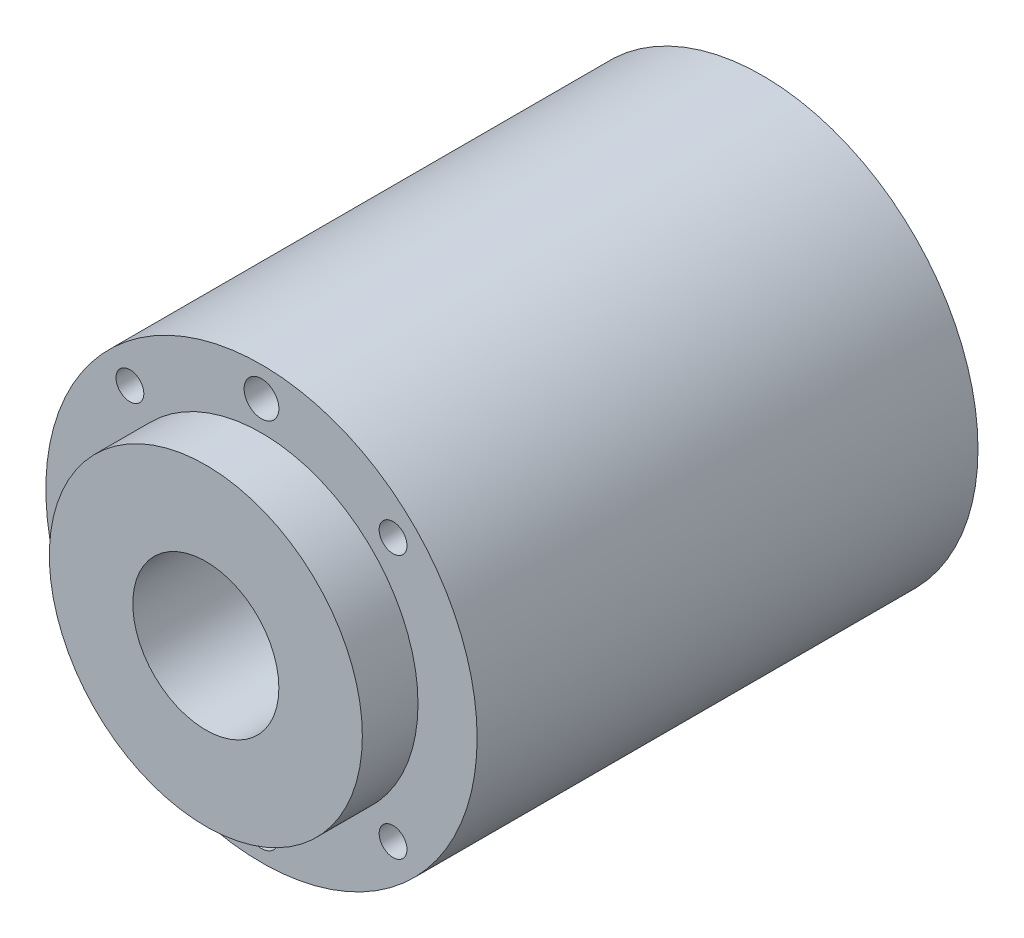
from build123d import *

# Parameters (mm, degrees)
SKETCH_1_R          = 31
SKETCH_1_R_2        = 10.5
EXTRUDE_1_DEPTH     = 72
EXTRUDE_START       = 8
SKETCH_1_3_R        = 22.5
SKETCH_1_3_R_2      = 10.5
EXTRUDE_2_DEPTH     = 8
SKETCH_2_R          = 2.5
SKETCH_2_R_2        = 2
CUT_EXTRUDE_3_DEPTH = 7


with BuildPart() as part:
    # 草图1 → 凸台-拉伸1 (new body)
    with BuildSketch(Plane.XY):
        Circle(SKETCH_1_R)
        Circle(SKETCH_1_R_2, mode=Mode.SUBTRACT)
    extrude(amount=-EXTRUDE_1_DEPTH)

    # 草图1<3> → 凸台-拉伸2 (add)
    with BuildSketch(Plane.XY.offset(EXTRUDE_START)):
        Circle(SKETCH_1_3_R)
        Circle(SKETCH_1_3_R_2, mode=Mode.SUBTRACT)
    extrude(amount=-EXTRUDE_2_DEPTH)

    # 草图2 → 切除-拉伸3 (cut)
    with BuildSketch(Plane.XY):
        with Locations((0, 26.75)):
            Circle(SKETCH_2_R)
        with Locations((18.915106397, 18.915106397)):
            Circle(SKETCH_2_R_2)
        with Locations((0, -26.75)):
            Circle(SKETCH_2_R)
        with Locations((18.915106397, -18.915106397)):
            Circle(SKETCH_2_R_2)
        with Locations((-18.915106397, -18.915106397)):
            Circle(SKETCH_2_R_2)
        with Locations((-18.915106397, 18.915106397)):
            Circle(SKETCH_2_R_2)
    extrude(amount=-CUT_EXTRUDE_3_DEPTH, mode=Mode.SUBTRACT)


solid = part.part
